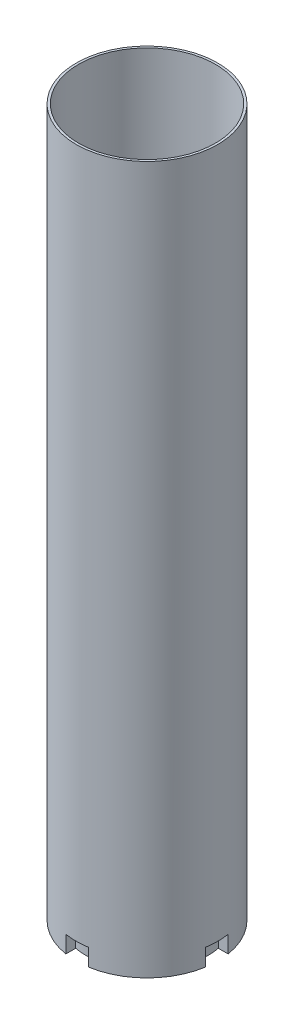
from build123d import *

# Parameters (mm, degrees)
SKETCH1_R           = 31
BOSS_EXTRUDE1_DEPTH = 310
SKETCH2_R           = 30
CUT_EXTRUDE1_DEPTH  = 300
CUT_EXTRUDE2_DEPTH  = 7.5


with BuildPart() as part:
    # Sketch1 → Boss-Extrude1 (new body)
    with BuildSketch(Plane(origin=(0, 0, 0), x_dir=(1, 0, 0), z_dir=(0, 1, 0))):
        with Locations(Location((0, 0, 0), (0, 0, 270))):
            Circle(SKETCH1_R)
    extrude(amount=BOSS_EXTRUDE1_DEPTH)

    # Sketch2 → Cut-Extrude1 (cut)
    with BuildSketch(Plane(origin=(0, 310, 0), x_dir=(1, 0, 0), z_dir=(0, 1, 0))):
        with Locations(Location((0, 0, 0), (0, 0, 270))):
            Circle(SKETCH2_R)
    extrude(amount=-CUT_EXTRUDE1_DEPTH, mode=Mode.SUBTRACT)

    # Sketch3 → Cut-Extrude2 (cut)
    with BuildSketch(Plane.XZ):
        with BuildLine():
            Line((-26.278555896, -5), (-30.594117082, -5))
            ThreePointArc((-30.594117082, -5), (-31, 0), (-30.594117082, 5))
            Line((-30.594117082, 5), (-26.278555896, 5))
            ThreePointArc((-26.278555896, 5), (-26.75, 0), (-26.278555896, -5))
        make_face()
        with BuildLine():
            Line((-5, -26.278555896), (-5, -30.594117082))
            ThreePointArc((-5, -30.594117082), (0, -31), (5, -30.594117082))
            Line((5, -30.594117082), (5, -26.278555896))
            ThreePointArc((5, -26.278555896), (0, -26.75), (-5, -26.278555896))
        make_face()
        with BuildLine():
            Line((-5, 26.278555896), (-5, 30.594117082))
            ThreePointArc((-5, 30.594117082), (0, 31), (5, 30.594117082))
            Line((5, 30.594117082), (5, 26.278555896))
            ThreePointArc((5, 26.278555896), (0, 26.75), (-5, 26.278555896))
        make_face()
        with BuildLine():
            Line((26.278555896, 5), (30.594117082, 5))
            ThreePointArc((30.594117082, 5), (31, 0), (30.594117082, -5))
            Line((30.594117082, -5), (26.278555896, -5))
            ThreePointArc((26.278555896, -5), (26.75, 0), (26.278555896, 5))
        make_face()
    extrude(amount=-CUT_EXTRUDE2_DEPTH, mode=Mode.SUBTRACT)


solid = part.part
